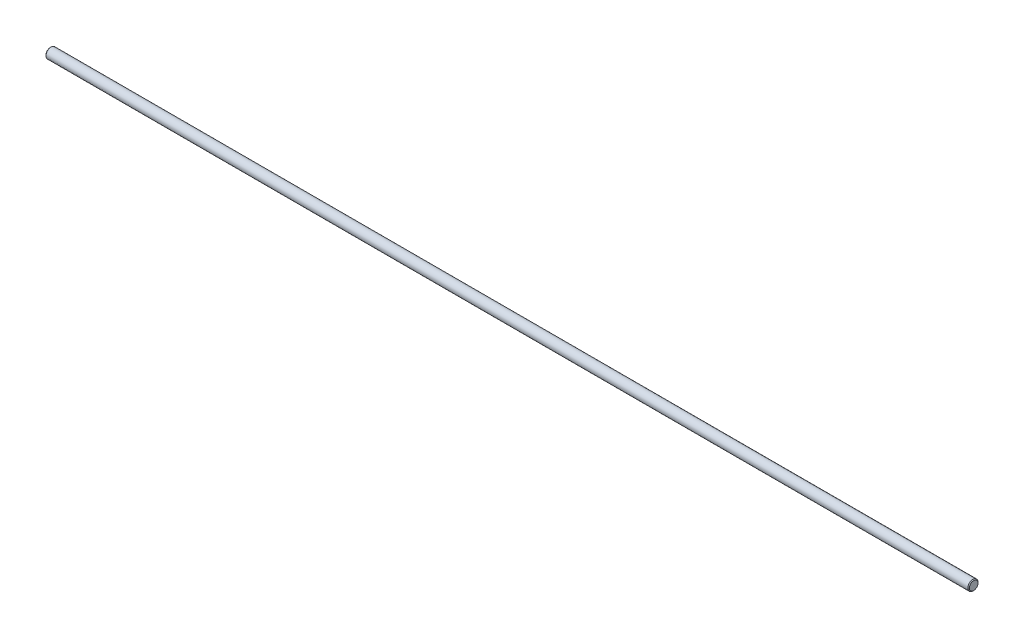
from build123d import *

# Parameters (mm, degrees)
SKETCH1_R           = 2
BOSS_EXTRUDE1_DEPTH = 182
CHAMFER1_SIZE       = 0.3


with BuildPart() as part:
    # Sketch1 → Boss-Extrude1 (new, symmetric)
    with BuildSketch(Plane(origin=(0, 0, 0), x_dir=(0, 0, -1), z_dir=(1, 0, 0))):
        Circle(SKETCH1_R)
    extrude(amount=BOSS_EXTRUDE1_DEPTH, both=True)

    # Chamfer1
    chamfer1_edges = [part.edges().sort_by_distance(p)[0] for p in [
        (-182, 0, 2),
        (182, 0, 2),
    ]]
    chamfer(chamfer1_edges, length=CHAMFER1_SIZE)


solid = part.part
